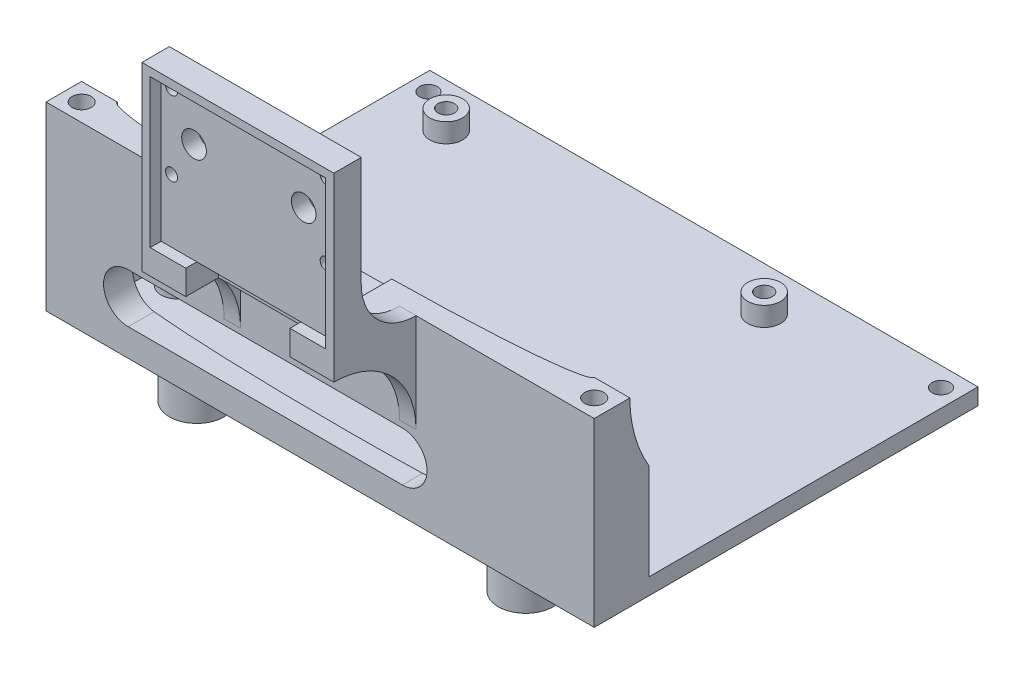
from build123d import *

# Parameters (mm, degrees)
SKETCH1_W                      = 100
SKETCH1_H                      = 32.5
SKETCH1_R                      = 1.5
SKETCH1_H_2                    = 37.5
BOSS_EXTRUDE1_DEPTH            = 3
BOSS_EXTRUDE2_DEPTH            = 30
CUT_EXTRUDE1_REACH             = 113.782
CUT_EXTRUDE1_DIRECTION_2_DEPTH = 112.782154211
CUT_EXTRUDE2_DEPTH             = 100
CUT_EXTRUDE3_REACH             = 94.136
SKETCH6_R                      = 1.75
CUT_EXTRUDE4_DEPTH             = 10
CUT_EXTRUDE5_START             = -30
CUT_EXTRUDE5_DEPTH             = 30
SKETCH9_R                      = 5
BOSS_EXTRUDE3_DEPTH            = 8
SKETCH10_R                     = 2.5
CUT_EXTRUDE6_DEPTH             = 6.5
SKETCH11_R                     = 1.625
CUT_EXTRUDE7_DEPTH             = 70.327123289
SKETCH19_R                     = 3
SKETCH19_R_2                   = 1.5
BOSS_EXTRUDE5_DEPTH            = 3.5
CUT_EXTRUDE12_REACH            = 113.782
BOSS_EXTRUDE4_DEPTH            = 17.5
CUT_EXTRUDE8_START             = -18
SKETCH13_W                     = 29
SKETCH13_H                     = 15
CUT_EXTRUDE8_DEPTH             = 15
SKETCH16_W                     = 32
SKETCH16_H                     = 27
CUT_EXTRUDE9_DEPTH             = 2
SKETCH17_W                     = 29
SKETCH17_H                     = 10
CUT_EXTRUDE10_DEPTH            = 10
CUT_EXTRUDE11_DEPTH            = 116.576814399
CUT_EXTRUDE11_DEPTH_BACK       = 116.576814399
SKETCH18_R                     = 1.1
SKETCH18_R_2                   = 2.25
SKETCH21_W                     = 19
SKETCH21_H                     = 4.5
CUT_EXTRUDE13_DEPTH            = 6


with BuildPart() as part:
    # Sketch1 → Boss-Extrude1 (new body)
    # profile 1 of 2: a face of its own
    with BuildSketch(Plane(origin=(0, 0, 0), x_dir=(1, 0, 0), z_dir=(0, 1, 0))):
        with Locations((0, 16.25)):
            Rectangle(SKETCH1_W, SKETCH1_H)
        with Locations(Location((-39, 24.5, 0), (0, 0, 270))):
            Circle(SKETCH1_R, mode=Mode.SUBTRACT)
        with Locations(Location((19, 24.5, 0), (0, 0, 270))):
            Circle(SKETCH1_R, mode=Mode.SUBTRACT)
    # profile 2 of 2: a face of its own
    with BuildSketch(Plane(origin=(0, 0, 0), x_dir=(1, 0, 0), z_dir=(0, 1, 0))):
        with Locations((0, -18.75)):
            Rectangle(SKETCH1_W, SKETCH1_H_2)
        with Locations(Location((-39, -24.5, 0), (0, 0, 270))):
            Circle(SKETCH1_R, mode=Mode.SUBTRACT)
        with Locations(Location((19, -24.5, 0), (0, 0, 270))):
            Circle(SKETCH1_R, mode=Mode.SUBTRACT)
    extrude(amount=BOSS_EXTRUDE1_DEPTH)

    # Sketch2 → Boss-Extrude2 (add)
    with BuildSketch(Plane(origin=(0, 3, 0), x_dir=(1, 0, 0), z_dir=(0, 1, 0))):
        Polygon((-43.5, 7.5), (-50, 7.5), (-50, -37.5), (50, -37.5), (50, 7.5), (43.5, 7.5), (43.5, -31), (-43.5, -31), align=None)
    extrude(amount=BOSS_EXTRUDE2_DEPTH)

    # Sketch3 → Cut-Extrude1 (cut, up to next)
    with BuildSketch(Plane(origin=(50, 0, 0), x_dir=(0, 0, -1), z_dir=(1, 0, 0)), mode=Mode.PRIVATE) as cut_extrude1_sk1:
        with BuildLine():
            add(Edge.make_bspline(
                [(-31, 33), (-31, 26.453463293), (-27.5, 20.502066286)],
                knots=[3.141592654, 3.141592654, 3.141592654, 3.58616643, 3.58616643, 3.58616643], degree=2, weights=[1, 0.917104056, 0.881131271]))
            Line((-27.5, 20.502066286), (7.5, 20.502066286))
            Line((7.5, 20.502066286), (7.5, 33))
            Line((7.5, 33), (-31, 33))
        make_face()
    cut_extrude1_tool1 = extrude(cut_extrude1_sk1.sketch, amount=-CUT_EXTRUDE1_REACH, mode=Mode.PRIVATE) & part.part
    # Sketch3 → Cut-Extrude1 (cut, up to next)
    with BuildSketch(Plane(origin=(50, 0, 0), x_dir=(0, 0, -1), z_dir=(1, 0, 0)), mode=Mode.PRIVATE) as cut_extrude1_sk2:
        with BuildLine():
            Line((7.5, 20.502066286), (-27.5, 20.502066286))
            add(Edge.make_bspline(
                [(-27.5, 20.502066286), (-17.207083574, 3), (7.5, 3)],
                knots=[3.58616643, 3.58616643, 3.58616643, 4.71238898, 4.71238898, 4.71238898], degree=2, weights=[0.881131271, 0.790002725, 1]))
            Line((7.5, 3), (7.5, 20.502066286))
        make_face()
    cut_extrude1_tool2 = extrude(cut_extrude1_sk2.sketch, amount=-CUT_EXTRUDE1_REACH, mode=Mode.PRIVATE) & part.part
    # Sketch3 → Cut-Extrude1 (cut, up to next)
    with BuildSketch(Plane(origin=(50, 0, 0), x_dir=(0, 0, -1), z_dir=(1, 0, 0)), mode=Mode.PRIVATE) as cut_extrude1_sk3:
        with BuildLine():
            add(Edge.make_bspline(
                [(-27.5, 20.502066286), (-17.207083574, 3), (7.5, 3)],
                knots=[3.58616643, 3.58616643, 3.58616643, 4.71238898, 4.71238898, 4.71238898], degree=2, weights=[0.881131271, 0.790002725, 1]))
            Line((-27.5, 20.502066286), (-27.5, 3))
            Line((-27.5, 3), (7.5, 3))
        make_face()
    cut_extrude1_tool3 = extrude(cut_extrude1_sk3.sketch, amount=-CUT_EXTRUDE1_REACH, mode=Mode.PRIVATE) & part.part
    add(cut_extrude1_tool1.solids().sort_by_distance((50, 26.847661, 11.192073))[0], mode=Mode.SUBTRACT)
    add(cut_extrude1_tool2.solids().sort_by_distance((50, 13.290058, 6.345651))[0], mode=Mode.SUBTRACT)
    add(cut_extrude1_tool3.solids().sort_by_distance((50, 7.818506, 19.337618))[0], mode=Mode.SUBTRACT)

    # Sketch3 → Cut-Extrude1 direction 2 (cut)
    with BuildSketch(Plane(origin=(50, 0, 0), x_dir=(0, 0, -1), z_dir=(1, 0, 0))):
        with BuildLine():
            add(Edge.make_bspline(
                [(-31, 33), (-31, 26.453463293), (-27.5, 20.502066286)],
                knots=[3.141592654, 3.141592654, 3.141592654, 3.58616643, 3.58616643, 3.58616643], degree=2, weights=[1, 0.917104056, 0.881131271]))
            Line((-27.5, 20.502066286), (7.5, 20.502066286))
            Line((7.5, 20.502066286), (7.5, 33))
            Line((7.5, 33), (-31, 33))
        make_face()
        with BuildLine():
            Line((7.5, 20.502066286), (-27.5, 20.502066286))
            add(Edge.make_bspline(
                [(-27.5, 20.502066286), (-17.207083574, 3), (7.5, 3)],
                knots=[3.58616643, 3.58616643, 3.58616643, 4.71238898, 4.71238898, 4.71238898], degree=2, weights=[0.881131271, 0.790002725, 1]))
            Line((7.5, 3), (7.5, 20.502066286))
        make_face()
        with BuildLine():
            add(Edge.make_bspline(
                [(-27.5, 20.502066286), (-17.207083574, 3), (7.5, 3)],
                knots=[3.58616643, 3.58616643, 3.58616643, 4.71238898, 4.71238898, 4.71238898], degree=2, weights=[0.881131271, 0.790002725, 1]))
            Line((-27.5, 20.502066286), (-27.5, 3))
            Line((-27.5, 3), (7.5, 3))
        make_face()
    extrude(amount=CUT_EXTRUDE1_DIRECTION_2_DEPTH, mode=Mode.SUBTRACT)

    # Sketch3<3> → Cut-Extrude2 (cut)
    with BuildSketch(Plane(origin=(50, 0, 0), x_dir=(0, 0, -1), z_dir=(1, 0, 0))):
        with BuildLine():
            add(Edge.make_bspline(
                [(-31, 33), (-31, 26.453463293), (-27.5, 20.502066286)],
                knots=[3.141592654, 3.141592654, 3.141592654, 3.58616643, 3.58616643, 3.58616643], degree=2, weights=[1, 0.917104056, 0.881131271]))
            Line((-27.5, 20.502066286), (7.5, 20.502066286))
            Line((7.5, 20.502066286), (7.5, 33))
            Line((7.5, 33), (-31, 33))
        make_face()
        with BuildLine():
            Line((7.5, 20.502066286), (-27.5, 20.502066286))
            add(Edge.make_bspline(
                [(-27.5, 20.502066286), (-17.207083574, 3), (7.5, 3)],
                knots=[3.58616643, 3.58616643, 3.58616643, 4.71238898, 4.71238898, 4.71238898], degree=2, weights=[0.881131271, 0.790002725, 1]))
            Line((7.5, 3), (7.5, 20.502066286))
        make_face()
    extrude(amount=-CUT_EXTRUDE2_DEPTH, mode=Mode.SUBTRACT)

    # Sketch4 → Cut-Extrude3 (cut, up to next)
    with BuildSketch(Plane.XY.offset(37.5), mode=Mode.PRIVATE) as cut_extrude3_sk1:
        with BuildLine():
            Line((-35, 14), (15, 14))
            ThreePointArc((15, 14), (19.5, 9.5), (15, 5))
            Line((15, 5), (-35, 5))
            ThreePointArc((-35, 5), (-39.5, 9.5), (-35, 14))
        make_face()
    cut_extrude3_tool1 = extrude(cut_extrude3_sk1.sketch, amount=-CUT_EXTRUDE3_REACH, mode=Mode.PRIVATE) & part.part
    add(cut_extrude3_tool1.solids().sort_by_distance((-10, 9.5, 37.5))[0], mode=Mode.SUBTRACT)

    # Sketch6 → Cut-Extrude4 (cut)
    with BuildSketch(Plane(origin=(0, 33, 0), x_dir=(1, 0, 0), z_dir=(0, 1, 0))):
        with Locations(Location((-46.75, -34.25, 0), (0, 0, 270))):
            Circle(SKETCH6_R)
        with Locations(Location((46.75, -34.25, 0), (0, 0, 270))):
            Circle(SKETCH6_R)
    extrude(amount=-CUT_EXTRUDE4_DEPTH, mode=Mode.SUBTRACT)

    # Sketch8 → Cut-Extrude5 (cut)
    with BuildSketch(Plane(origin=(0, 33, 0), x_dir=(1, 0, 0), z_dir=(0, 1, 0)).offset(CUT_EXTRUDE5_START)):
        with BuildLine():
            Line((-43.5, -31), (43.5, -31))
            add(Edge.make_bspline(
                [(-43.5, -31), (-43.5, -34), (0, -34), (43.5, -34), (43.5, -31)],
                knots=[0, 0, 0, 1.570796327, 1.570796327, 3.141592654, 3.141592654, 3.141592654], degree=2, weights=[1, 0.707106781, 1, 0.707106781, 1]))
        make_face()
    extrude(amount=CUT_EXTRUDE5_DEPTH, mode=Mode.SUBTRACT)

    # Sketch9 → Boss-Extrude3 (add)
    with BuildSketch(Plane.XZ):
        with Locations(Location((-30, 30, 0), (0, 0, 90))):
            Circle(SKETCH9_R)
        with Locations(Location((-30, -25, 0), (0, 0, 90))):
            Circle(SKETCH9_R)
        with Locations(Location((30, -25, 0), (0, 0, 90))):
            Circle(SKETCH9_R)
        with Locations(Location((30, 30, 0), (0, 0, 90))):
            Circle(SKETCH9_R)
    extrude(amount=BOSS_EXTRUDE3_DEPTH)

    # Sketch10 → Cut-Extrude6 (cut)
    with BuildSketch(Plane.XZ.offset(8)):
        with Locations(Location((-30, 30, 0), (0, 0, 270))):
            Circle(SKETCH10_R)
        with Locations(Location((-30, -25, 0), (0, 0, 270))):
            Circle(SKETCH10_R)
        with Locations(Location((30, -25, 0), (0, 0, 270))):
            Circle(SKETCH10_R)
        with Locations(Location((30, 30, 0), (0, 0, 270))):
            Circle(SKETCH10_R)
    extrude(amount=-CUT_EXTRUDE6_DEPTH, mode=Mode.SUBTRACT)

    # Sketch11 → Cut-Extrude7 (cut, through all)
    with BuildSketch(Plane(origin=(0, 3, 0), x_dir=(1, 0, 0), z_dir=(0, 1, 0))):
        with Locations(Location((46.75, 29, 0), (0, 0, 270))):
            Circle(SKETCH11_R)
        with Locations(Location((-46.75, 29, 0), (0, 0, 270))):
            Circle(SKETCH11_R)
    extrude(amount=-CUT_EXTRUDE7_DEPTH, mode=Mode.SUBTRACT)

    # Sketch19 → Boss-Extrude5 (add)
    # profile 1 of 4: a face of its own
    with BuildSketch(Plane(origin=(0, 3, 0), x_dir=(1, 0, 0), z_dir=(0, 1, 0))):
        with Locations(Location((-39, -24.5, 0), (0, 0, 270))):
            Circle(SKETCH19_R)
        with Locations(Location((-39, -24.5, 0), (0, 0, 270))):
            Circle(SKETCH19_R_2, mode=Mode.SUBTRACT)
    # profile 2 of 4: a face of its own
    with BuildSketch(Plane(origin=(0, 3, 0), x_dir=(1, 0, 0), z_dir=(0, 1, 0))):
        with Locations(Location((19, -24.5, 0), (0, 0, 270))):
            Circle(SKETCH19_R)
        with Locations(Location((19, -24.5, 0), (0, 0, 270))):
            Circle(SKETCH19_R_2, mode=Mode.SUBTRACT)
    # profile 3 of 4: a face of its own
    with BuildSketch(Plane(origin=(0, 3, 0), x_dir=(1, 0, 0), z_dir=(0, 1, 0))):
        with Locations(Location((19, 24.5, 0), (0, 0, 270))):
            Circle(SKETCH19_R)
        with Locations(Location((19, 24.5, 0), (0, 0, 270))):
            Circle(SKETCH19_R_2, mode=Mode.SUBTRACT)
    # profile 4 of 4: a face of its own
    with BuildSketch(Plane(origin=(0, 3, 0), x_dir=(1, 0, 0), z_dir=(0, 1, 0))):
        with Locations(Location((-39, 24.5, 0), (0, 0, 270))):
            Circle(SKETCH19_R)
        with Locations(Location((-39, 24.5, 0), (0, 0, 270))):
            Circle(SKETCH19_R_2, mode=Mode.SUBTRACT)
    extrude(amount=BOSS_EXTRUDE5_DEPTH)

    # Sketch20 → Cut-Extrude12 (cut, up to next)
    with BuildSketch(Plane.ZY.offset(50), mode=Mode.PRIVATE) as cut_extrude12_sk1:
        with BuildLine():
            add(Edge.make_bspline(
                [(-7.5, 3), (0.308515322, 3), (7.5, 5.370606777)],
                knots=[4.71238898, 4.71238898, 4.71238898, 5.112597496, 5.112597496, 5.112597496], degree=2, weights=[1, 0.98004586, 1]))
            Line((-7.5, 3), (7.5, 3))
            Line((7.5, 3), (7.5, 5.370606777))
        make_face()
    cut_extrude12_tool1 = extrude(cut_extrude12_sk1.sketch, amount=-CUT_EXTRUDE12_REACH, mode=Mode.PRIVATE) & part.part
    add(cut_extrude12_tool1.solids().sort_by_distance((-50, 3.706091, 3.780274))[0], mode=Mode.SUBTRACT)

    # Sketch12 → Boss-Extrude4 (add, symmetric)
    with BuildSketch(Plane(origin=(0, 0, 0), x_dir=(0, 0, -1), z_dir=(1, 0, 0))):
        with BuildLine():
            ThreePointArc((-37.5, 33), (-44.571067812, 35.928932188), (-47.5, 43))
            Line((-47.5, 43), (-47.5, 63))
            Line((-47.5, 63), (-52.5, 63))
            Line((-52.5, 63), (-52.5, 30))
            ThreePointArc((-52.5, 30), (-41.893398282, 25.606601718), (-37.5, 15))
            Line((-37.5, 15), (-37.5, 33))
        make_face()
    extrude(amount=BOSS_EXTRUDE4_DEPTH, both=True)

    # Sketch13 → Cut-Extrude8 (cut)
    with BuildSketch(Plane(origin=(0, 33, 0), x_dir=(1, 0, 0), z_dir=(0, 1, 0)).offset(CUT_EXTRUDE8_START)):
        with Locations((0, -45)):
            Rectangle(SKETCH13_W, SKETCH13_H)
    extrude(amount=CUT_EXTRUDE8_DEPTH, mode=Mode.SUBTRACT)

    # Sketch16 → Cut-Extrude9 (cut)
    with BuildSketch(Plane.XY.offset(52.5)):
        with Locations((0, 48)):
            Rectangle(SKETCH16_W, SKETCH16_H)
    extrude(amount=-CUT_EXTRUDE9_DEPTH, mode=Mode.SUBTRACT)

    # Sketch17 → Cut-Extrude10 (cut)
    with BuildSketch(Plane(origin=(0, 33, 0), x_dir=(1, 0, 0), z_dir=(0, 1, 0))):
        with Locations((0, -42.5)):
            Rectangle(SKETCH17_W, SKETCH17_H)
    extrude(amount=CUT_EXTRUDE10_DEPTH, mode=Mode.SUBTRACT)

    # Sketch18 → Cut-Extrude11 (cut, two sides: drawn at the far end of the back side and taken through both)
    with BuildSketch(Plane.XY.offset(50.5).offset(-CUT_EXTRUDE11_DEPTH_BACK)):
        with BuildLine():
            Line((-9.5, 34.5), (-9.5, 33))
            ThreePointArc((-9.5, 33), (-9.060660172, 31.939339828), (-8, 31.5))
            Line((-8, 31.5), (8, 31.5))
            ThreePointArc((8, 31.5), (9.060660172, 31.939339828), (9.5, 33))
            Line((9.5, 33), (9.5, 34.5))
            Line((9.5, 34.5), (-9.5, 34.5))
        make_face()
        with Locations((14.1, 59.6)):
            Circle(SKETCH18_R)
        with Locations((14.1, 46)):
            Circle(SKETCH18_R)
        with Locations((-14.1, 59.6)):
            Circle(SKETCH18_R)
        with Locations((-14.1, 46)):
            Circle(SKETCH18_R)
        with Locations((-10, 52.8)):
            Circle(SKETCH18_R_2)
        with Locations((10, 52.8)):
            Circle(SKETCH18_R_2)
    extrude(amount=CUT_EXTRUDE11_DEPTH + CUT_EXTRUDE11_DEPTH_BACK, mode=Mode.SUBTRACT)

    # Sketch21 → Cut-Extrude13 (cut)
    with BuildSketch(Plane.XY.offset(52.5)):
        with Locations((0, 32.25)):
            Rectangle(SKETCH21_W, SKETCH21_H)
    extrude(amount=-CUT_EXTRUDE13_DEPTH, mode=Mode.SUBTRACT)


solid = part.part
